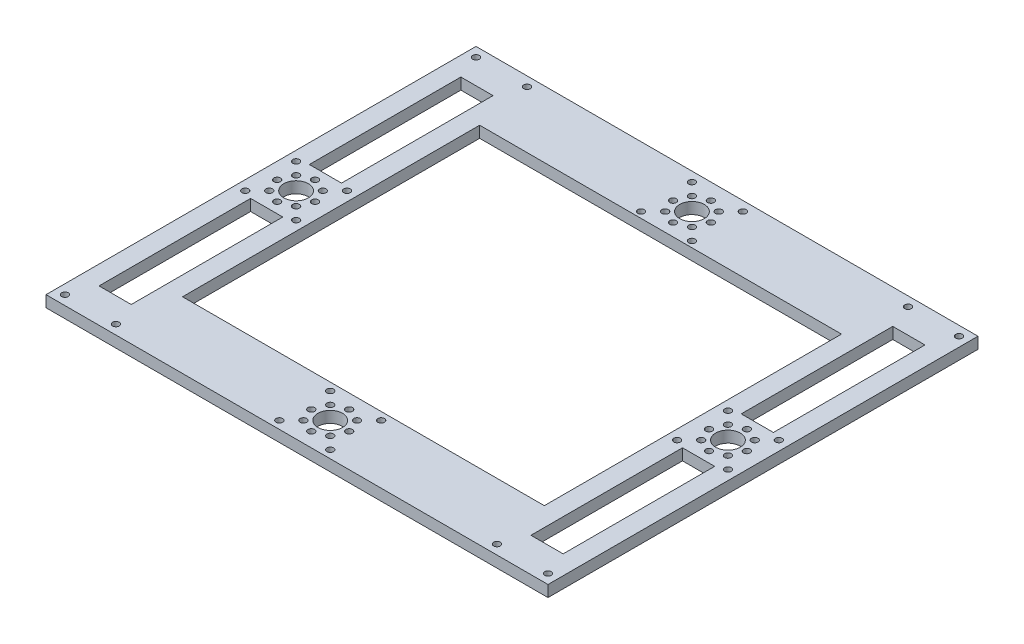
from build123d import *

# Parameters (mm, degrees)
ESQUISSE1_W        = 265
ESQUISSE1_H        = 227
ESQUISSE1_R        = 6.5
ESQUISSE1_R_2      = 1.75
ESQUISSE1_R_3      = 1.749999999
ESQUISSE1_W_2      = 191
ESQUISSE1_H_2      = 156.859849262
ESQUISSE1_W_3      = 17
ESQUISSE1_H_3      = 80
BOSS_EXTRU_1_DEPTH = 6


with BuildPart() as part:
    # Esquisse1 → Boss.-Extru.1 (new body)
    with BuildSketch(Plane(origin=(0, 0, 0), x_dir=(1, 0, 0), z_dir=(0, 1, 0))):
        with Locations((132.5, -113.5)):
            Rectangle(ESQUISSE1_W, ESQUISSE1_H)
        with Locations(Location((246.5, -113.5, 0), (0, 0, 270))):
            Circle(ESQUISSE1_R, mode=Mode.SUBTRACT)
        with Locations(Location((246.5, -103.5, 0), (0, 0, 270))):
            Circle(ESQUISSE1_R_2, mode=Mode.SUBTRACT)
        with Locations(Location((253.571068024, -106.4289324, 0), (0, 0, 270))):
            Circle(ESQUISSE1_R_2, mode=Mode.SUBTRACT)
        with Locations(Location((256.5, -113.5, 0), (0, 0, 270))):
            Circle(ESQUISSE1_R_2, mode=Mode.SUBTRACT)
        with Locations(Location((253.571067812, -120.571067812, 0), (0, 0, 270))):
            Circle(ESQUISSE1_R_2, mode=Mode.SUBTRACT)
        with Locations(Location((246.5, -123.5, 0), (0, 0, 270))):
            Circle(ESQUISSE1_R_2, mode=Mode.SUBTRACT)
        with Locations(Location((239.428932188, -120.571067812, 0), (0, 0, 270))):
            Circle(ESQUISSE1_R_2, mode=Mode.SUBTRACT)
        with Locations(Location((236.5, -113.5, 0), (0, 0, 270))):
            Circle(ESQUISSE1_R_2, mode=Mode.SUBTRACT)
        with Locations(Location((239.42893238, -106.428931957, 0), (0, 0, 270))):
            Circle(ESQUISSE1_R_3, mode=Mode.SUBTRACT)
        with Locations(Location((259.935029054, -100.064971369, 0), (0, 0, 270))):
            Circle(ESQUISSE1_R_2, mode=Mode.SUBTRACT)
        with Locations(Location((259.935028843, -126.935028843, 0), (0, 0, 270))):
            Circle(ESQUISSE1_R_2, mode=Mode.SUBTRACT)
        with Locations(Location((233.064971369, -100.064970946, 0), (0, 0, 270))):
            Circle(ESQUISSE1_R_2, mode=Mode.SUBTRACT)
        with Locations(Location((233.064971157, -126.935028843, 0), (0, 0, 270))):
            Circle(ESQUISSE1_R_2, mode=Mode.SUBTRACT)
        with Locations(Location((132.5, -209.464962315, 0), (0, 0, 270))):
            Circle(ESQUISSE1_R, mode=Mode.SUBTRACT)
        with Locations(Location((132.5, -199.464962315, 0), (0, 0, 270))):
            Circle(ESQUISSE1_R_2, mode=Mode.SUBTRACT)
        with Locations(Location((139.571068024, -202.393894715, 0), (0, 0, 270))):
            Circle(ESQUISSE1_R_2, mode=Mode.SUBTRACT)
        with Locations(Location((142.5, -209.464962315, 0), (0, 0, 270))):
            Circle(ESQUISSE1_R_2, mode=Mode.SUBTRACT)
        with Locations(Location((139.571067812, -216.536030127, 0), (0, 0, 270))):
            Circle(ESQUISSE1_R_2, mode=Mode.SUBTRACT)
        with Locations(Location((132.5, -219.464962315, 0), (0, 0, 270))):
            Circle(ESQUISSE1_R_2, mode=Mode.SUBTRACT)
        with Locations(Location((125.428932188, -216.536030127, 0), (0, 0, 270))):
            Circle(ESQUISSE1_R_2, mode=Mode.SUBTRACT)
        with Locations(Location((122.5, -209.464962315, 0), (0, 0, 270))):
            Circle(ESQUISSE1_R_2, mode=Mode.SUBTRACT)
        with Locations(Location((125.42893238, -202.393894272, 0), (0, 0, 270))):
            Circle(ESQUISSE1_R_3, mode=Mode.SUBTRACT)
        with Locations(Location((145.935029054, -196.029933685, 0), (0, 0, 270))):
            Circle(ESQUISSE1_R_2, mode=Mode.SUBTRACT)
        with Locations(Location((145.935028843, -222.899991158, 0), (0, 0, 270))):
            Circle(ESQUISSE1_R_2, mode=Mode.SUBTRACT)
        with Locations(Location((119.064971369, -196.029933261, 0), (0, 0, 270))):
            Circle(ESQUISSE1_R_2, mode=Mode.SUBTRACT)
        with Locations(Location((119.064971157, -222.899991158, 0), (0, 0, 270))):
            Circle(ESQUISSE1_R_2, mode=Mode.SUBTRACT)
        with Locations(Location((18.513965978, -113.5, 0), (0, 0, 270))):
            Circle(ESQUISSE1_R, mode=Mode.SUBTRACT)
        with Locations(Location((18.513965978, -103.5, 0), (0, 0, 270))):
            Circle(ESQUISSE1_R_2, mode=Mode.SUBTRACT)
        with Locations(Location((25.585034002, -106.4289324, 0), (0, 0, 270))):
            Circle(ESQUISSE1_R_2, mode=Mode.SUBTRACT)
        with Locations(Location((28.513965978, -113.5, 0), (0, 0, 270))):
            Circle(ESQUISSE1_R_2, mode=Mode.SUBTRACT)
        with Locations(Location((25.58503379, -120.571067812, 0), (0, 0, 270))):
            Circle(ESQUISSE1_R_2, mode=Mode.SUBTRACT)
        with Locations(Location((18.513965978, -123.5, 0), (0, 0, 270))):
            Circle(ESQUISSE1_R_2, mode=Mode.SUBTRACT)
        with Locations(Location((11.442898166, -120.571067812, 0), (0, 0, 270))):
            Circle(ESQUISSE1_R_2, mode=Mode.SUBTRACT)
        with Locations(Location((8.513965978, -113.5, 0), (0, 0, 270))):
            Circle(ESQUISSE1_R_2, mode=Mode.SUBTRACT)
        with Locations(Location((11.442898358, -106.428931957, 0), (0, 0, 270))):
            Circle(ESQUISSE1_R_3, mode=Mode.SUBTRACT)
        with Locations(Location((31.948995033, -100.064971369, 0), (0, 0, 270))):
            Circle(ESQUISSE1_R_2, mode=Mode.SUBTRACT)
        with Locations(Location((31.948994821, -126.935028843, 0), (0, 0, 270))):
            Circle(ESQUISSE1_R_2, mode=Mode.SUBTRACT)
        with Locations(Location((5.078937347, -100.064970946, 0), (0, 0, 270))):
            Circle(ESQUISSE1_R_2, mode=Mode.SUBTRACT)
        with Locations(Location((5.078937136, -126.935028843, 0), (0, 0, 270))):
            Circle(ESQUISSE1_R_2, mode=Mode.SUBTRACT)
        with Locations(Location((132.5, -18.5, 0), (0, 0, 270))):
            Circle(ESQUISSE1_R, mode=Mode.SUBTRACT)
        with Locations(Location((132.5, -8.5, 0), (0, 0, 270))):
            Circle(ESQUISSE1_R_2, mode=Mode.SUBTRACT)
        with Locations(Location((139.571068024, -11.4289324, 0), (0, 0, 270))):
            Circle(ESQUISSE1_R_2, mode=Mode.SUBTRACT)
        with Locations(Location((142.5, -18.5, 0), (0, 0, 270))):
            Circle(ESQUISSE1_R_2, mode=Mode.SUBTRACT)
        with Locations(Location((139.571067812, -25.571067812, 0), (0, 0, 270))):
            Circle(ESQUISSE1_R_2, mode=Mode.SUBTRACT)
        with Locations(Location((132.5, -28.5, 0), (0, 0, 270))):
            Circle(ESQUISSE1_R_2, mode=Mode.SUBTRACT)
        with Locations(Location((125.428932188, -25.571067812, 0), (0, 0, 270))):
            Circle(ESQUISSE1_R_2, mode=Mode.SUBTRACT)
        with Locations(Location((122.5, -18.5, 0), (0, 0, 270))):
            Circle(ESQUISSE1_R_2, mode=Mode.SUBTRACT)
        with Locations(Location((125.42893238, -11.428931957, 0), (0, 0, 270))):
            Circle(ESQUISSE1_R_3, mode=Mode.SUBTRACT)
        with Locations(Location((145.935029054, -5.064971369, 0), (0, 0, 270))):
            Circle(ESQUISSE1_R_2, mode=Mode.SUBTRACT)
        with Locations(Location((145.935028843, -31.935028843, 0), (0, 0, 270))):
            Circle(ESQUISSE1_R_2, mode=Mode.SUBTRACT)
        with Locations(Location((119.064971369, -5.064970946, 0), (0, 0, 270))):
            Circle(ESQUISSE1_R_2, mode=Mode.SUBTRACT)
        with Locations(Location((119.064971157, -31.935028843, 0), (0, 0, 270))):
            Circle(ESQUISSE1_R_2, mode=Mode.SUBTRACT)
        with Locations(Location((260, -5, 0), (0, 0, 270))):
            Circle(ESQUISSE1_R_2, mode=Mode.SUBTRACT)
        with Locations(Location((233.064971369, -5, 0), (0, 0, 270))):
            Circle(ESQUISSE1_R_2, mode=Mode.SUBTRACT)
        with Locations(Location((260, -222, 0), (0, 0, 90))):
            Circle(ESQUISSE1_R_2, mode=Mode.SUBTRACT)
        with Locations(Location((233.064971369, -222, 0), (0, 0, 90))):
            Circle(ESQUISSE1_R_2, mode=Mode.SUBTRACT)
        with Locations(Location((5, -5, 0), (0, 0, 90))):
            Circle(ESQUISSE1_R_2, mode=Mode.SUBTRACT)
        with Locations(Location((31.935028631, -5, 0), (0, 0, 90))):
            Circle(ESQUISSE1_R_2, mode=Mode.SUBTRACT)
        with Locations(Location((5, -222, 0), (0, 0, 270))):
            Circle(ESQUISSE1_R_2, mode=Mode.SUBTRACT)
        with Locations(Location((31.935028631, -222, 0), (0, 0, 270))):
            Circle(ESQUISSE1_R_2, mode=Mode.SUBTRACT)
        with Locations((132.5, -113.5)):
            Rectangle(ESQUISSE1_W_2, ESQUISSE1_H_2, mode=Mode.SUBTRACT)
        with Locations((246.5, -58)):
            Rectangle(ESQUISSE1_W_3, ESQUISSE1_H_3, mode=Mode.SUBTRACT)
        with Locations((246.5, -169)):
            Rectangle(ESQUISSE1_W_3, ESQUISSE1_H_3, mode=Mode.SUBTRACT)
        with Locations((18.5, -58)):
            Rectangle(ESQUISSE1_W_3, ESQUISSE1_H_3, mode=Mode.SUBTRACT)
        with Locations((18.5, -169)):
            Rectangle(ESQUISSE1_W_3, ESQUISSE1_H_3, mode=Mode.SUBTRACT)
    extrude(amount=BOSS_EXTRU_1_DEPTH)


solid = part.part
